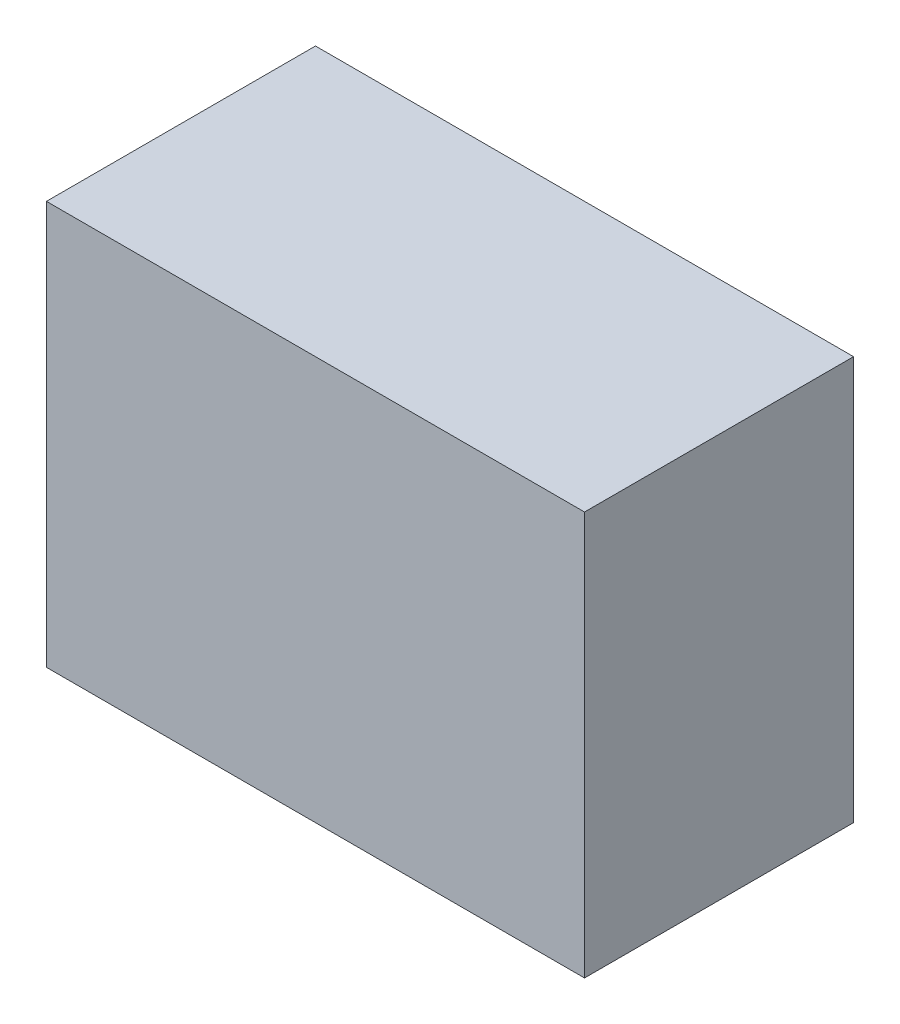
from build123d import *

# Parameters (mm, degrees)
SKETCH1_W           = 400
SKETCH1_H           = 300
BOSS_EXTRUDE1_DEPTH = 200


with BuildPart() as part:
    # Sketch1 → Boss-Extrude1 (new body)
    with BuildSketch(Plane.XY):
        Rectangle(SKETCH1_W, SKETCH1_H)
    extrude(amount=-BOSS_EXTRUDE1_DEPTH)


solid = part.part
